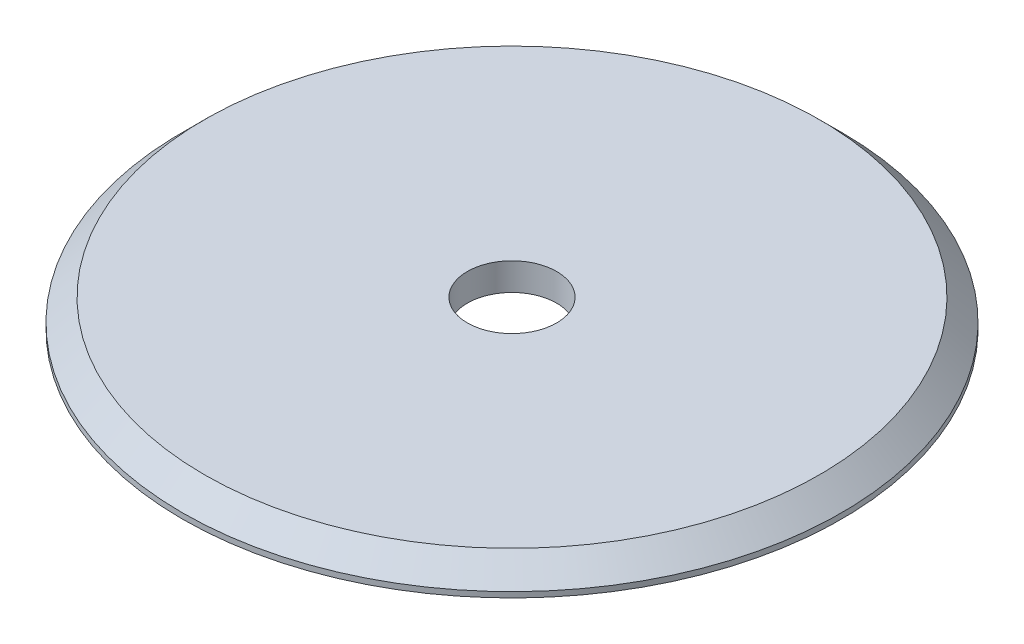
from build123d import *

# Parameters (mm, degrees)
SKIZZE1_R                       = 24
SKIZZE1_R_2                     = 3.25
AUFSATZ_LINEAR_AUSTRAGEN1_DEPTH = 2
FASE1_SIZE                      = 1.6
SKIZZE2_R                       = 14
SKIZZE2_R_2                     = 12
AUFSATZ_LINEAR_AUSTRAGEN2_DEPTH = 0.6


with BuildPart() as part:
    # Skizze1 → Aufsatz-Linear austragen1 (new body)
    with BuildSketch(Plane(origin=(0, 0, 0), x_dir=(1, 0, 0), z_dir=(0, 1, 0))):
        with Locations(Location((0, 0, 0), (0, 0, 270))):
            Circle(SKIZZE1_R)
        with Locations(Location((0, 0, 0), (0, 0, 270))):
            Circle(SKIZZE1_R_2, mode=Mode.SUBTRACT)
    extrude(amount=AUFSATZ_LINEAR_AUSTRAGEN1_DEPTH)

    # Fase1
    fase1_edges = [part.edges().sort_by_distance(p)[0] for p in [
        (0, 2, -24),
    ]]
    chamfer(fase1_edges, length=FASE1_SIZE)

    # Skizze2 → Aufsatz-Linear austragen2 (add)
    with BuildSketch(Plane.XZ):
        with Locations(Location((0, 0, 0), (0, 0, 90))):
            Circle(SKIZZE2_R)
        with Locations(Location((0, 0, 0), (0, 0, 270))):
            Circle(SKIZZE2_R_2, mode=Mode.SUBTRACT)
    extrude(amount=AUFSATZ_LINEAR_AUSTRAGEN2_DEPTH)


solid = part.part
